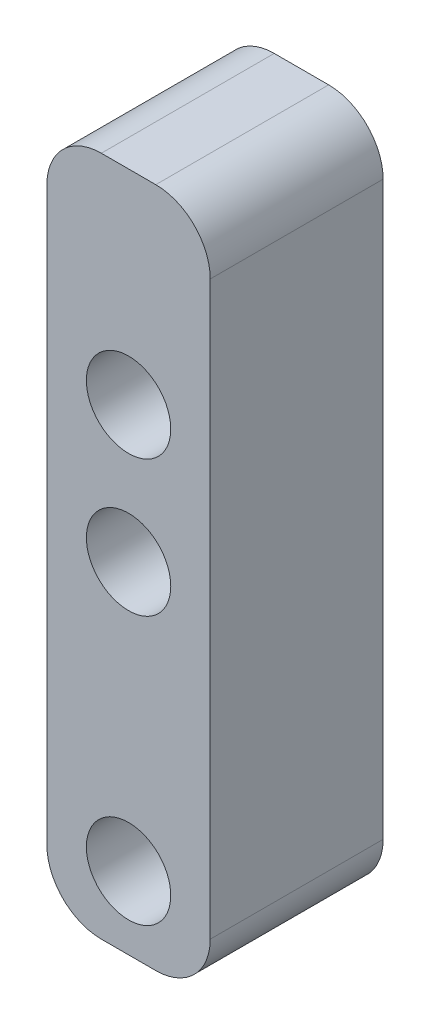
from build123d import *

# Parameters (mm, degrees)
ESQUISSE1_W        = 6
ESQUISSE1_H        = 25
ESQUISSE1_R        = 1.55
BOSS_EXTRU_1_DEPTH = 6.35
CONG_1_R           = 2


with BuildPart() as part:
    # Esquisse1 → Boss.-Extru.1 (new body)
    with BuildSketch(Plane.XY):
        Rectangle(ESQUISSE1_W, ESQUISSE1_H)
        with Locations(Location((0, -9.837865065, 0), (0, 0, 180))):
            Circle(ESQUISSE1_R, mode=Mode.SUBTRACT)
        Circle(ESQUISSE1_R, mode=Mode.SUBTRACT)
        with Locations((0, 5)):
            Circle(ESQUISSE1_R, mode=Mode.SUBTRACT)
    extrude(amount=BOSS_EXTRU_1_DEPTH)

    # Congé1
    cong_1_edges = [part.edges().sort_by_distance(p)[0] for p in [
        (3, -12.5, 3.175),
        (-3, -12.5, 3.175),
        (-3, 12.5, 3.175),
        (3, 12.5, 3.175),
    ]]
    fillet(cong_1_edges, radius=CONG_1_R)


solid = part.part
